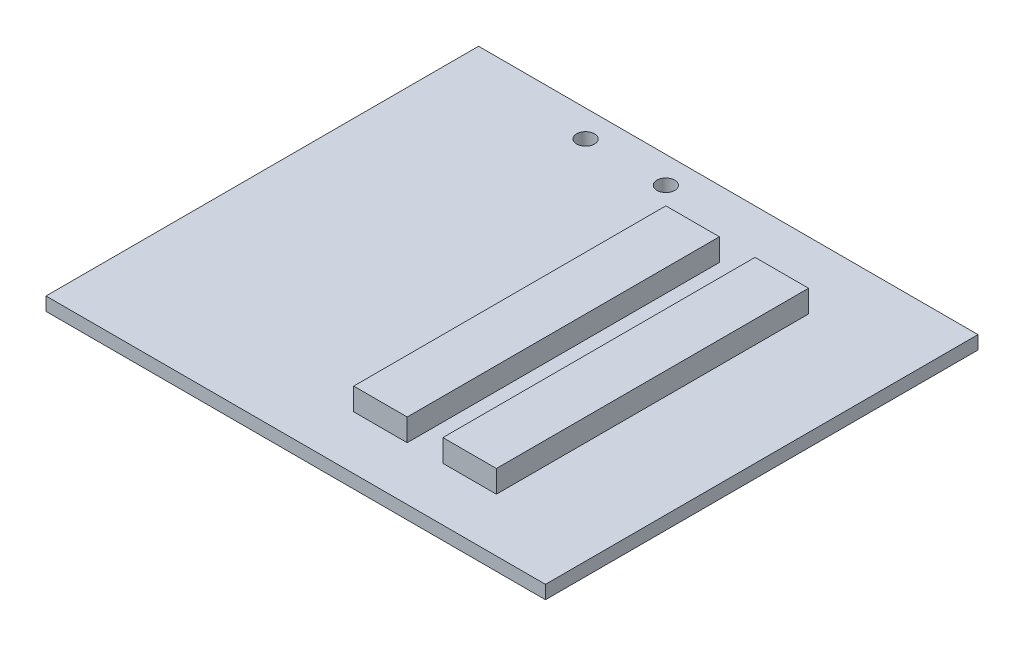
from build123d import *

# Parameters (mm, degrees)
SKETCH_1_W      = 56
SKETCH_1_H      = 48.5
SKETCH_1_R      = 1
EXTRUDE_1_DEPTH = 1.5
SKETCH_2_W      = 6
SKETCH_2_H      = 35
EXTRUDE_2_DEPTH = 2.5
SKETCH_3_W      = 6
SKETCH_3_H      = 12
EXTRUDE_3_DEPTH = 4.5


with BuildPart() as part:
    # Эскиз1 → Бобышка-Вытянуть1 (new body)
    with BuildSketch(Plane(origin=(0, 0, 0), x_dir=(1, 0, 0), z_dir=(0, 1, 0))):
        Rectangle(SKETCH_1_W, SKETCH_1_H)
        with Locations(Location((-13, 21.25, 0), (0, 0, 270))):
            Circle(SKETCH_1_R, mode=Mode.SUBTRACT)
        with Locations(Location((-4, 21.25, 0), (0, 0, 270))):
            Circle(SKETCH_1_R, mode=Mode.SUBTRACT)
    extrude(amount=EXTRUDE_1_DEPTH)

    # Эскиз2 → Бобышка-Вытянуть2 (add)
    with BuildSketch(Plane(origin=(0, 1.5, 0), x_dir=(1, 0, 0), z_dir=(0, 1, 0))):
        with Locations((3.5, -0.75)):
            Rectangle(SKETCH_2_W, SKETCH_2_H)
        with Locations((13.5, -0.75)):
            Rectangle(SKETCH_2_W, SKETCH_2_H)
    extrude(amount=EXTRUDE_2_DEPTH)

    # Эскиз3 → Бобышка-Вытянуть3 (add)
    with BuildSketch(Plane.XZ):
        with Locations((-25.5, -7.25)):
            Rectangle(SKETCH_3_W, SKETCH_3_H)
    extrude(amount=EXTRUDE_3_DEPTH)


solid = part.part
